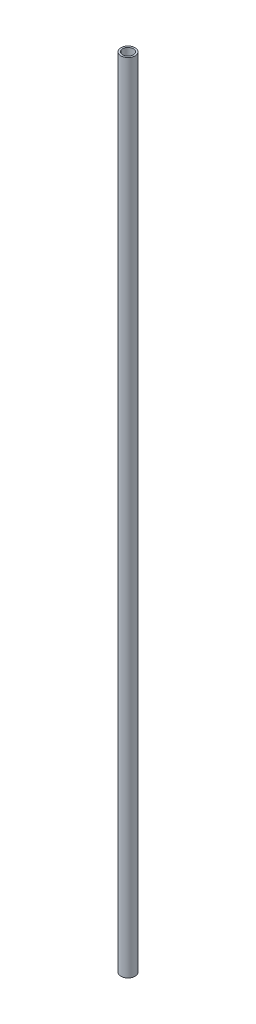
from build123d import *

# Parameters (mm, degrees)
SKETCH2_R   = 4
SKETCH2_R_2 = 3


with BuildPart() as part:
    # Sweep1: sweep along a path in Sketch1
    with BuildLine(Plane.XY) as sweep1_path:
        Line((0, 0), (0, 450))
    # Sketch2 → Sweep1 (sweep)
    with BuildSketch(Plane(origin=(0, 0, 0), x_dir=(1, 0, 0), z_dir=(0, 1, 0))):
        Circle(SKETCH2_R)
        Circle(SKETCH2_R_2, mode=Mode.SUBTRACT)
    sweep(path=sweep1_path.line)


solid = part.part
